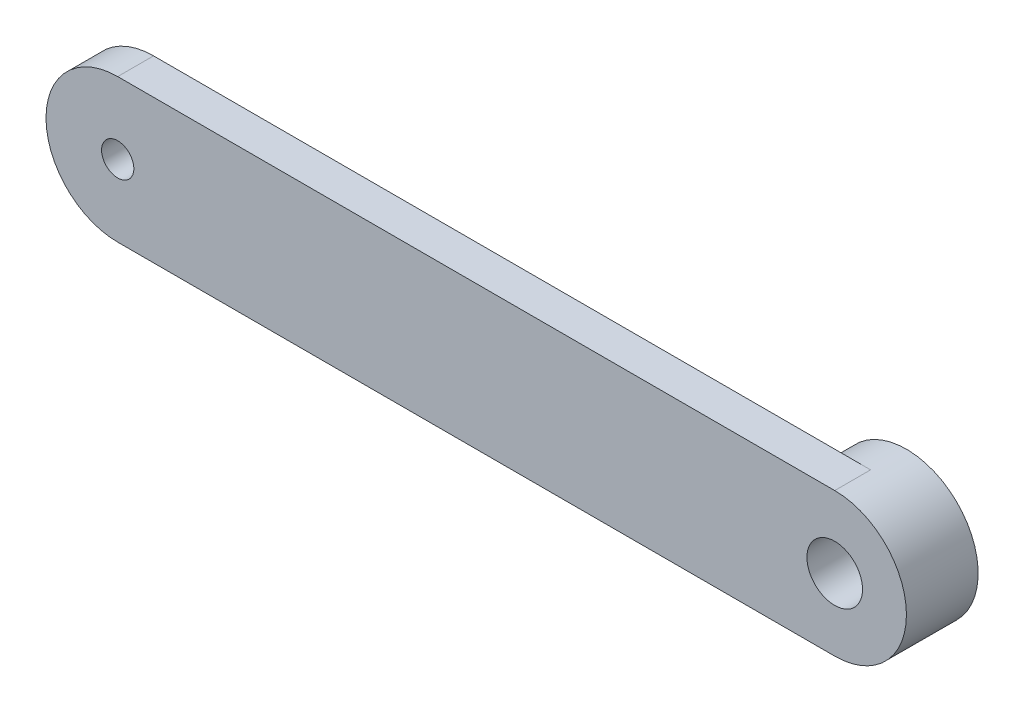
from build123d import *
from build123d.topology import SkipClean

# Parameters (mm, degrees)
SKETCH_1_R      = 1.55
SKETCH_1_R_2    = 0.9
EXTRUDE_1_DEPTH = 2
EXTRUDE_START   = 2
SKETCH_2_R      = 2
SKETCH_2_R_2    = 0.9
EXTRUDE_2_DEPTH = 2
SKETCH_3_R      = 4
SKETCH_3_R_2    = 1.55
EXTRUDE_3_DEPTH = 2


with BuildPart() as part:
    # 草图1 → 凸台-拉伸1 (new body)
    with BuildSketch(Plane.XY):
        with BuildLine():
            Line((20, -4), (-20, -4))
            ThreePointArc((-20, -4), (-24, 0), (-20, 4))
            Line((-20, 4), (20, 4))
            ThreePointArc((20, 4), (24, 0), (20, -4))
        make_face()
        with Locations((20, 0)):
            Circle(SKETCH_1_R, mode=Mode.SUBTRACT)
        with Locations((-20, 0)):
            Circle(SKETCH_1_R_2, mode=Mode.SUBTRACT)
    extrude(amount=EXTRUDE_1_DEPTH)

    # 草图2 → 凸台-拉伸2 (add)
    with SkipClean():  # the faces are left unmerged after this step: merging them gives an invalid solid
        with BuildSketch(Plane(origin=(0, 0, 0), x_dir=(-1, 0, 0), z_dir=(0, 0, -1)).offset(EXTRUDE_START)):
            with Locations(Location((20, 0, 0), (0, 0, 180))):
                Circle(SKETCH_2_R)
            with Locations((20, 0)):
                Circle(SKETCH_2_R_2, mode=Mode.SUBTRACT)
        extrude(amount=-EXTRUDE_2_DEPTH)

    # 草图3 → 凸台-拉伸3 (add)
    with SkipClean():  # the faces are left unmerged after this step: merging them gives an invalid solid
        with BuildSketch(Plane(origin=(0, 0, 0), x_dir=(-1, 0, 0), z_dir=(0, 0, -1)).offset(EXTRUDE_START)):
            with Locations((-20, 0)):
                Circle(SKETCH_3_R)
            with Locations((-20, 0)):
                Circle(SKETCH_3_R_2, mode=Mode.SUBTRACT)
        extrude(amount=-EXTRUDE_3_DEPTH)


solid = part.part
